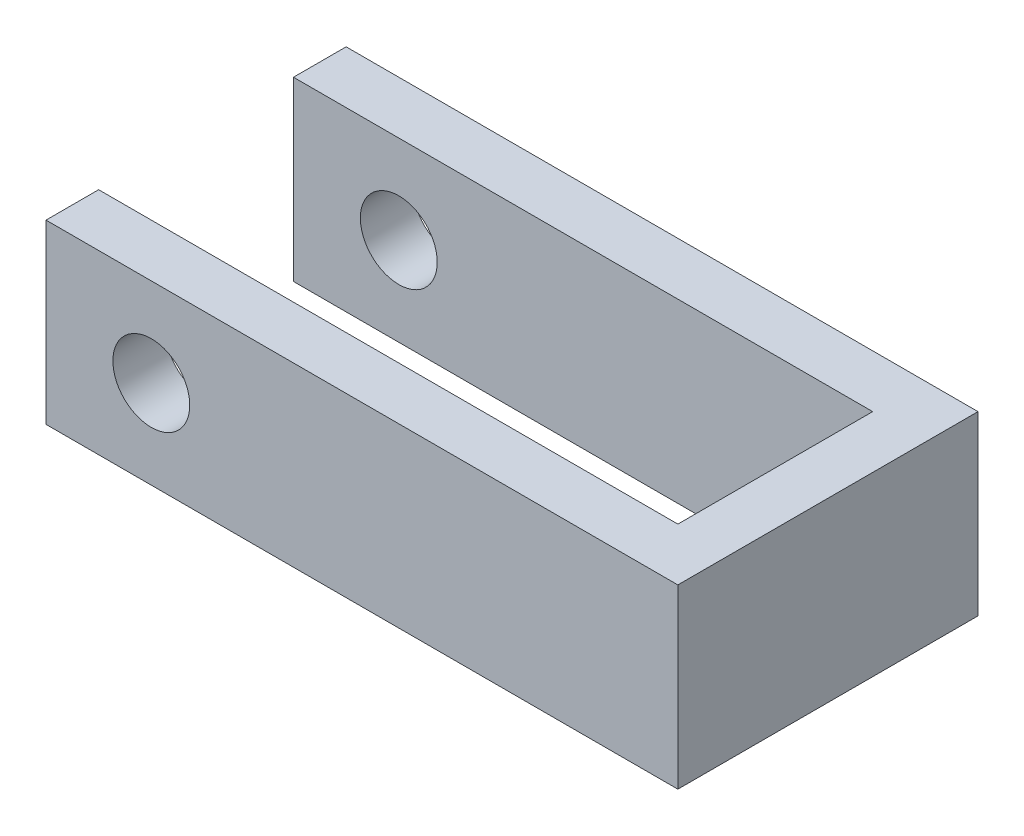
from build123d import *

# Parameters (mm, degrees)
BOSS_EXTRUDE2_DEPTH = 16.8
SKETCH5_R           = 3.65
CUT_EXTRUDE3_DEPTH  = 28.5


with BuildPart() as part:
    # Sketch1 → Boss-Extrude2 (new body)
    with BuildSketch(Plane(origin=(0, 0, 0), x_dir=(1, 0, 0), z_dir=(0, 1, 0))):
        Polygon((2.5, -9.25), (-2.5, -9.25), (-57.5, -9.25), (-57.5, -14.25), (2.5, -14.25), align=None)
        Polygon((2.5, 9.25), (-2.5, 9.25), (-2.5, 4.25), (-2.5, -9.25), (2.5, -9.25), align=None)
        Polygon((-57.5, 9.25), (-2.5, 9.25), (2.5, 9.25), (2.5, 14.25), (-57.5, 14.25), align=None)
    extrude(amount=-BOSS_EXTRUDE2_DEPTH)

    # Sketch5 → Cut-Extrude3 (cut)
    with BuildSketch(Plane.XY.offset(14.25)):
        with Locations((-47.5, -8.4)):
            Circle(SKETCH5_R)
    extrude(amount=-CUT_EXTRUDE3_DEPTH, mode=Mode.SUBTRACT)


solid = part.part
